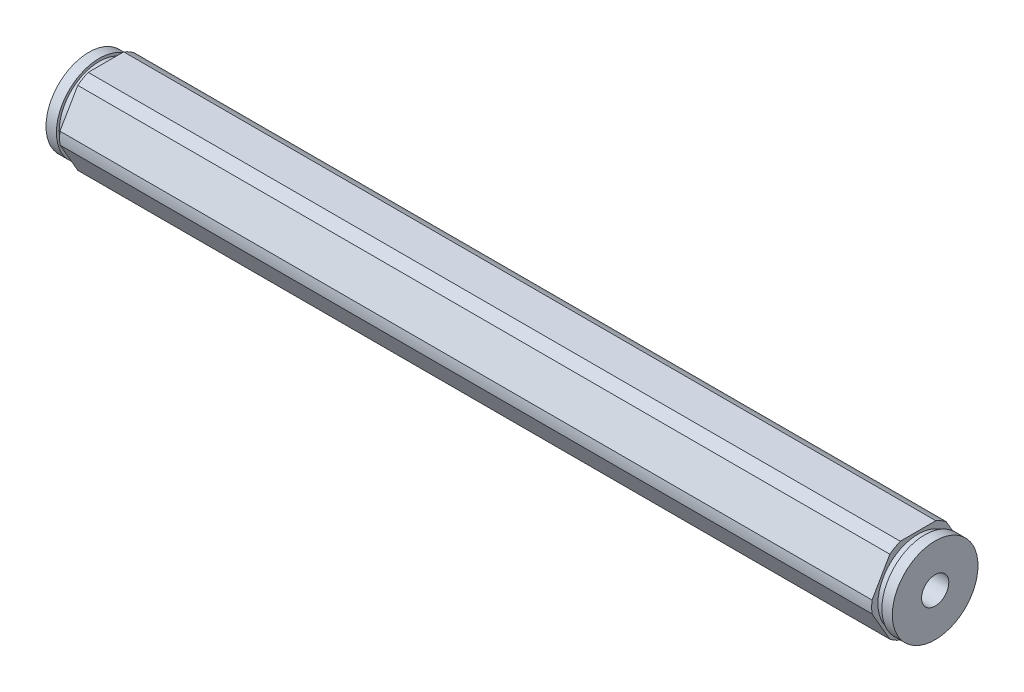
from build123d import *

# Parameters (mm, degrees)
BOSS_EXTRUDE1_DEPTH = 62.738
SKETCH3_R           = 7.332348419
SKETCH3_R_2         = 6.875
SKETCH3_R_3         = 2.0193
CUT_EXTRUDE1_DEPTH  = 126.850357208


with BuildPart() as part:
    # Sketch1 → Boss-Extrude1 (new, symmetric)
    with BuildSketch(Plane(origin=(0, 0, 0), x_dir=(0, 0, -1), z_dir=(1, 0, 0))):
        Polygon((7.332348419, 0), (3.666174209, 6.35), (-3.666174209, 6.35), (-7.332348419, 0), (-3.666174209, -6.35), (3.666174209, -6.35), align=None)
    extrude(amount=BOSS_EXTRUDE1_DEPTH, both=True)

    # Sketch2 → Cut-Revolve1 (revolve, cut)
    with BuildSketch(Plane(origin=(0, 0, 0), x_dir=(1, 0, 0), z_dir=(0, 1, 0))):
        Polygon((60.198, -5.9436), (61.1886, -5.9436), (61.1886, -6.35), (62.738, -6.35), (62.738, -8.89), (60.198, -8.89), align=None)
    cut_revolve1 = revolve(axis=Axis((0, 0, 0), (1, 0, 0)), mode=Mode.SUBTRACT)

    # Mirror1: Cut-Revolve1 across plane
    add(cut_revolve1.mirror(Plane(origin=(0, 0, 0), x_dir=(0, 0, 1), z_dir=(1, 0, 0))), mode=Mode.SUBTRACT)

    # Sketch3 → Cut-Extrude1 (cut, through all)
    # profile 1 of 2: a face of its own
    with BuildSketch(Plane(origin=(62.738, 0, 0), x_dir=(0, 0, -1), z_dir=(1, 0, 0))):
        Circle(SKETCH3_R)
        Circle(SKETCH3_R_2, mode=Mode.SUBTRACT)
    # profile 2 of 2: a face of its own
    with BuildSketch(Plane(origin=(62.738, 0, 0), x_dir=(0, 0, -1), z_dir=(1, 0, 0))):
        Circle(SKETCH3_R_3)
    extrude(amount=-CUT_EXTRUDE1_DEPTH, mode=Mode.SUBTRACT)


solid = part.part
